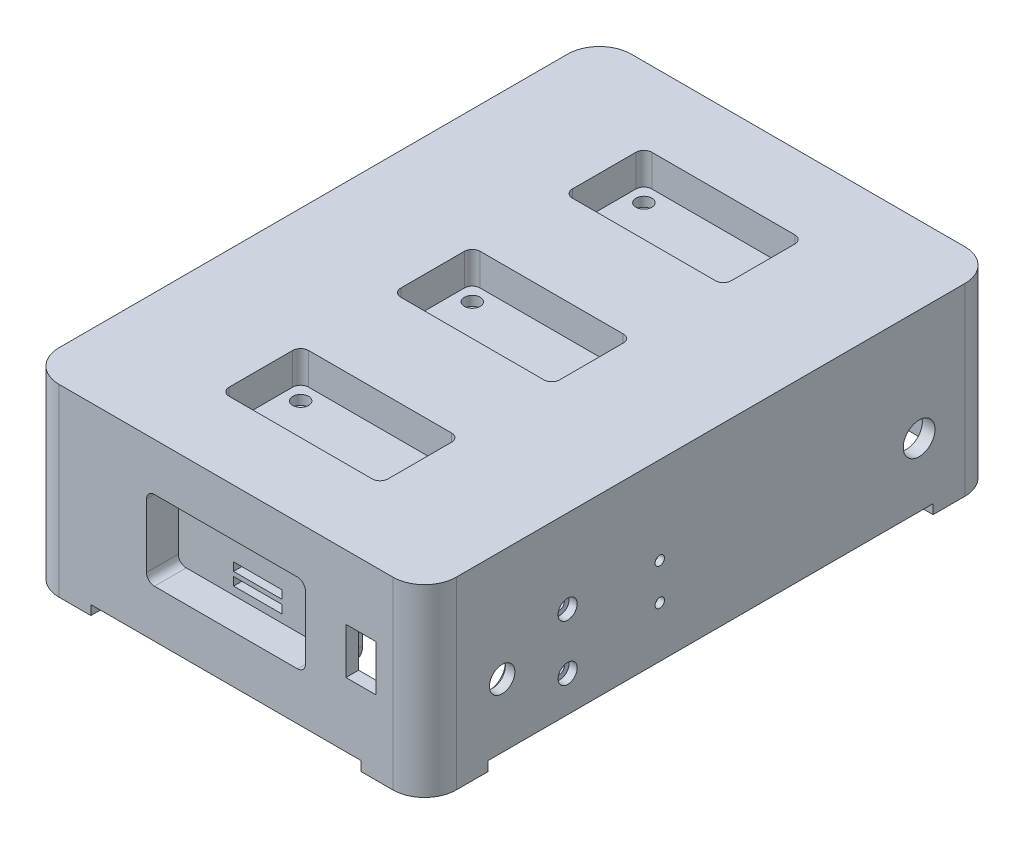
from build123d import *

# Parameters (mm, degrees)
SKETCH_1_W                = 125
SKETCH_1_H                = 180
EXTRUDE_1_DEPTH           = 55
CUT_EXTRUDE_1_DEPTH       = 10
CUT_EXTRUDE_2_DEPTH       = 10
SHELL_1_T                 = -4
SKETCH_5_R                = 1.45
SKETCH_5_R_2              = 4
SKETCH_5_R_3              = 5
CUT_EXTRUDE_3_DEPTH       = 15
SKETCH_6_R                = 3
CUT_EXTRUDE_4_DEPTH       = 2.5
SKETCH_11_R               = 5
CUT_EXTRUDE_16_DEPTH      = 1
SKETCH_12_R               = 1.45
CUT_EXTRUDE_17_DEPTH      = 14
SKETCH_15_R               = 2.5
SKETCH_15_W               = 15.2
SKETCH_15_H               = 2.6
CUT_EXTRUDE_20_DEPTH      = 3
SKETCH_16_W               = 14
SKETCH_16_H               = 1.8
CUT_EXTRUDE_21_DEPTH      = 3
SKETCH_17_R               = 2.5
SKETCH_17_W               = 15.2
SKETCH_17_H               = 2.6
CUT_EXTRUDE_22_DEPTH      = 3
SKETCH_18_W               = 14
SKETCH_18_H               = 1.8
CUT_EXTRUDE_23_DEPTH      = 3
SKETCH_19_R               = 2.5
SKETCH_19_W               = 15.2
SKETCH_19_H               = 2.6
CUT_EXTRUDE_24_DEPTH      = 3
SKETCH_20_W               = 14
SKETCH_20_H               = 1.8
CUT_EXTRUDE_25_DEPTH      = 5
SKETCH_21_W               = 9.5
SKETCH_21_H               = 14.5
CUT_EXTRUDE_26_DEPTH      = 4
SKETCH_22_R               = 1.425
CUT_EXTRUDE_27_DEPTH      = 9
SKETCH_24_R               = 1.475
CUT_EXTRUDE_28_DEPTH      = 164.554272338
FILLET_1_R                = 10
CUT_EXTRUDE_29_DEPTH      = 119
CUT_EXTRUDE_29_DEPTH_BACK = 2
FILLET_2_R                = 3
EXTRUDE_2_DEPTH           = 3
CUT_EXTRUDE_30_DEPTH      = 2.5


with BuildPart() as part:
    # Эскиз1 → Бобышка-Вытянуть1 (new body)
    with BuildSketch(Plane(origin=(0, 0, 0), x_dir=(1, 0, 0), z_dir=(0, 1, 0))):
        Rectangle(SKETCH_1_W, SKETCH_1_H)
    extrude(amount=EXTRUDE_1_DEPTH)

    # Эскиз2 → Вырез-Вытянуть1 (cut)
    with BuildSketch(Plane.XY.offset(90)):
        with BuildLine():
            Line((-22.5, 15), (22.5, 15))
            ThreePointArc((22.5, 15), (24.267766953, 15.732233047), (25, 17.5))
            Line((25, 17.5), (25, 37.5))
            ThreePointArc((25, 37.5), (24.267766953, 39.267766953), (22.5, 40))
            Line((22.5, 40), (-22.5, 40))
            ThreePointArc((-22.5, 40), (-24.267766953, 39.267766953), (-25, 37.5))
            Line((-25, 37.5), (-25, 17.5))
            ThreePointArc((-25, 17.5), (-24.267766953, 15.732233047), (-22.5, 15))
        make_face()
    cut_extrude_1 = extrude(amount=-CUT_EXTRUDE_1_DEPTH, mode=Mode.SUBTRACT)

    # Эскиз4 → Вырез-Вытянуть2 (cut)
    with BuildSketch(Plane(origin=(0, 55, 0), x_dir=(1, 0, 0), z_dir=(0, 1, 0))):
        with BuildLine():
            Line((-22.5, 41.5), (22.5, 41.5))
            ThreePointArc((22.5, 41.5), (24.267766953, 42.232233047), (25, 44))
            Line((25, 44), (25, 64))
            ThreePointArc((25, 64), (24.267766953, 65.767766953), (22.5, 66.5))
            Line((22.5, 66.5), (-22.5, 66.5))
            ThreePointArc((-22.5, 66.5), (-24.267766953, 65.767766953), (-25, 64))
            Line((-25, 64), (-25, 44))
            ThreePointArc((-25, 44), (-24.267766953, 42.232233047), (-22.5, 41.5))
        make_face()
        with BuildLine():
            Line((-22.5, -12.5), (22.5, -12.5))
            ThreePointArc((22.5, -12.5), (24.267766953, -11.767766953), (25, -10))
            Line((25, -10), (25, 10))
            ThreePointArc((25, 10), (24.267766953, 11.767766953), (22.5, 12.5))
            Line((22.5, 12.5), (-22.5, 12.5))
            ThreePointArc((-22.5, 12.5), (-24.267766953, 11.767766953), (-25, 10))
            Line((-25, 10), (-25, -10))
            ThreePointArc((-25, -10), (-24.267766953, -11.767766953), (-22.5, -12.5))
        make_face()
        with BuildLine():
            Line((-22.5, -66.5), (22.5, -66.5))
            ThreePointArc((22.5, -66.5), (24.267766953, -65.767766953), (25, -64))
            Line((25, -64), (25, -44))
            ThreePointArc((25, -44), (24.267766953, -42.232233047), (22.5, -41.5))
            Line((22.5, -41.5), (-22.5, -41.5))
            ThreePointArc((-22.5, -41.5), (-24.267766953, -42.232233047), (-25, -44))
            Line((-25, -44), (-25, -64))
            ThreePointArc((-25, -64), (-24.267766953, -65.767766953), (-22.5, -66.5))
        make_face()
    extrude(amount=-CUT_EXTRUDE_2_DEPTH, mode=Mode.SUBTRACT)

    # Зеркальное отражение1: Вырез-Вытянуть1 across plane
    add(cut_extrude_1.mirror(Plane.XY), mode=Mode.SUBTRACT)

    # Оболочка1
    shell_1_openings = [part.faces().sort_by_distance(p)[0] for p in [
        (0, 0, 0),
    ]]
    offset(amount=SHELL_1_T, openings=shell_1_openings, kind=Kind.INTERSECTION)

    # Эскиз5 → Вырез-Вытянуть3 (cut)
    with BuildSketch(Plane.ZY.offset(62.5)):
        with Locations((45, 28.75)):
            Circle(SKETCH_5_R)
        with Locations((45, 11.25)):
            Circle(SKETCH_5_R)
        with Locations((65.6, 20)):
            Circle(SKETCH_5_R_2)
        with Locations((-65.6, 20)):
            Circle(SKETCH_5_R_3)
    cut_extrude_3 = extrude(amount=-CUT_EXTRUDE_3_DEPTH, mode=Mode.SUBTRACT)

    # Эскиз6 → Вырез-Вытянуть4 (cut)
    with BuildSketch(Plane.ZY.offset(62.5)):
        with Locations((45, 28.75)):
            Circle(SKETCH_6_R)
        with Locations((45, 11.25)):
            Circle(SKETCH_6_R)
    cut_extrude_4 = extrude(amount=-CUT_EXTRUDE_4_DEPTH, mode=Mode.SUBTRACT)

    # Эскиз11 → Вырез-Вытянуть16 (cut)
    with BuildSketch(Plane(origin=(-58.5, 0, 0), x_dir=(0, 0, -1), z_dir=(1, 0, 0))):
        with Locations((-65.6, 20)):
            Circle(SKETCH_11_R)
    cut_extrude_16 = extrude(amount=-CUT_EXTRUDE_16_DEPTH, mode=Mode.SUBTRACT)

    # Зеркальное отражение2: Вырез-Вытянуть3, Вырез-Вытянуть4, Вырез-Вытянуть16 across plane
    add(cut_extrude_3.mirror(Plane(origin=(0, 0, 0), x_dir=(0, 0, 1), z_dir=(1, 0, 0))), mode=Mode.SUBTRACT)
    add(cut_extrude_4.mirror(Plane(origin=(0, 0, 0), x_dir=(0, 0, 1), z_dir=(1, 0, 0))), mode=Mode.SUBTRACT)
    add(cut_extrude_16.mirror(Plane(origin=(0, 0, 0), x_dir=(0, 0, 1), z_dir=(1, 0, 0))), mode=Mode.SUBTRACT)

    # Эскиз12 → Вырез-Вытянуть17 (cut)
    with BuildSketch(Plane(origin=(0, 11, 0), x_dir=(-1, 0, 0), z_dir=(0, -1, 0))):
        with Locations(Location((-10, -78, 0), (0, 0, 90))):
            Circle(SKETCH_12_R)
        with Locations(Location((10, -78, 0), (0, 0, 90))):
            Circle(SKETCH_12_R)
    extrude(amount=-CUT_EXTRUDE_17_DEPTH, mode=Mode.SUBTRACT)

    # Эскиз15 → Вырез-Вытянуть20 (cut)
    with BuildSketch(Plane(origin=(0, 45, 0), x_dir=(1, 0, 0), z_dir=(0, 1, 0))):
        with Locations(Location((-20, -46.5, 0), (0, 0, 270))):
            Circle(SKETCH_15_R)
        with Locations(Location((20, -46.5, 0), (0, 0, 270))):
            Circle(SKETCH_15_R)
        with Locations(Location((-20, 7.5, 0), (0, 0, 270))):
            Circle(SKETCH_15_R)
        with Locations(Location((20, 7.5, 0), (0, 0, 270))):
            Circle(SKETCH_15_R)
        with Locations(Location((-20, 61.5, 0), (0, 0, 270))):
            Circle(SKETCH_15_R)
        with Locations(Location((20, 61.5, 0), (0, 0, 270))):
            Circle(SKETCH_15_R)
        with Locations((0, -62.5)):
            Rectangle(SKETCH_15_W, SKETCH_15_H)
        with Locations((0, -8.5)):
            Rectangle(SKETCH_15_W, SKETCH_15_H)
        with Locations((0, 45.5)):
            Rectangle(SKETCH_15_W, SKETCH_15_H)
        with Locations((0, -58.5)):
            Rectangle(SKETCH_15_W, SKETCH_15_H)
        with Locations((0, -4.5)):
            Rectangle(SKETCH_15_W, SKETCH_15_H)
        with Locations((0, 49.5)):
            Rectangle(SKETCH_15_W, SKETCH_15_H)
    extrude(amount=-CUT_EXTRUDE_20_DEPTH, mode=Mode.SUBTRACT)

    # Эскиз16 → Вырез-Вытянуть21 (cut)
    with BuildSketch(Plane(origin=(0, 42, 0), x_dir=(1, 0, 0), z_dir=(0, 1, 0))):
        with Locations((0, -62.5)):
            Rectangle(SKETCH_16_W, SKETCH_16_H)
        with Locations((0, -8.5)):
            Rectangle(SKETCH_16_W, SKETCH_16_H)
        with Locations((0, 45.5)):
            Rectangle(SKETCH_16_W, SKETCH_16_H)
        with Locations((0, -58.5)):
            Rectangle(SKETCH_16_W, SKETCH_16_H)
        with Locations((0, -4.5)):
            Rectangle(SKETCH_16_W, SKETCH_16_H)
        with Locations((0, 49.5)):
            Rectangle(SKETCH_16_W, SKETCH_16_H)
    extrude(amount=-CUT_EXTRUDE_21_DEPTH, mode=Mode.SUBTRACT)

    # Эскиз17 → Вырез-Вытянуть22 (cut)
    with BuildSketch(Plane.XY.offset(80)):
        with Locations((-20, 35)):
            Circle(SKETCH_17_R)
        with Locations((20, 35)):
            Circle(SKETCH_17_R)
        with Locations((0, 18.8)):
            Rectangle(SKETCH_17_W, SKETCH_17_H)
        with Locations((0, 22.8)):
            Rectangle(SKETCH_17_W, SKETCH_17_H)
    extrude(amount=-CUT_EXTRUDE_22_DEPTH, mode=Mode.SUBTRACT)

    # Эскиз18 → Вырез-Вытянуть23 (cut)
    with BuildSketch(Plane.XY.offset(77)):
        with Locations((0, 18.8)):
            Rectangle(SKETCH_18_W, SKETCH_18_H)
        with Locations((0, 22.8)):
            Rectangle(SKETCH_18_W, SKETCH_18_H)
    extrude(amount=-CUT_EXTRUDE_23_DEPTH, mode=Mode.SUBTRACT)

    # Эскиз19 → Вырез-Вытянуть24 (cut)
    with BuildSketch(Plane(origin=(0, 0, -80), x_dir=(1, 0, 0), z_dir=(0, 0, -1))):
        with Locations(Location((-20, -20, 0), (0, 0, 270))):
            Circle(SKETCH_19_R)
        with Locations(Location((20, -20, 0), (0, 0, 270))):
            Circle(SKETCH_19_R)
        with Locations((0, -36.2)):
            Rectangle(SKETCH_19_W, SKETCH_19_H)
        with Locations((0, -32.2)):
            Rectangle(SKETCH_19_W, SKETCH_19_H)
    extrude(amount=-CUT_EXTRUDE_24_DEPTH, mode=Mode.SUBTRACT)

    # Эскиз20 → Вырез-Вытянуть25 (cut)
    with BuildSketch(Plane(origin=(0, 0, -77), x_dir=(1, 0, 0), z_dir=(0, 0, -1))):
        with Locations((0, -36.2)):
            Rectangle(SKETCH_20_W, SKETCH_20_H)
        with Locations((0, -32.2)):
            Rectangle(SKETCH_20_W, SKETCH_20_H)
    extrude(amount=-CUT_EXTRUDE_25_DEPTH, mode=Mode.SUBTRACT)

    # Эскиз21 → Вырез-Вытянуть26 (cut)
    with BuildSketch(Plane(origin=(0, 0, 90), x_dir=(1, 0, 0), z_dir=(0, 0, -1))):
        with Locations((42.5, -27.5)):
            Rectangle(SKETCH_21_W, SKETCH_21_H)
    extrude(amount=CUT_EXTRUDE_26_DEPTH, mode=Mode.SUBTRACT)

    # Эскиз22 → Вырез-Вытянуть27 (cut)
    with BuildSketch(Plane(origin=(0, 0, 0), x_dir=(-1, 0, 0), z_dir=(0, -1, 0))):
        with Locations(Location((0, 88, 0), (0, 0, 90))):
            Circle(SKETCH_22_R)
        with Locations(Location((0, -88, 0), (0, 0, 90))):
            Circle(SKETCH_22_R)
        with Locations(Location((-60.5, 0, 0), (0, 0, 90))):
            Circle(SKETCH_22_R)
        with Locations(Location((60.5, 0, 0), (0, 0, 90))):
            Circle(SKETCH_22_R)
    extrude(amount=-CUT_EXTRUDE_27_DEPTH, mode=Mode.SUBTRACT)

    # Эскиз24 → Вырез-Вытянуть28 (cut, through all)
    with BuildSketch(Plane.ZY.offset(62.5)):
        with Locations((16, 16)):
            Circle(SKETCH_24_R)
        with Locations((16, 27.5)):
            Circle(SKETCH_24_R)
    extrude(amount=-CUT_EXTRUDE_28_DEPTH, mode=Mode.SUBTRACT)

    # Скругление1
    fillet_1_edges = [part.edges().sort_by_distance(p)[0] for p in [
        (62.5, 27.5, 90),
        (-62.5, 27.5, 90),
        (-62.5, 27.5, -90),
        (62.5, 27.5, -90),
    ]]
    fillet(fillet_1_edges, radius=FILLET_1_R)

    # Эскиз26 → Вырез-Вытянуть29 (cut, two sides: drawn at the far end of the back side and taken through both)
    with BuildSketch(Plane.ZY.offset(-58.5).offset(-CUT_EXTRUDE_29_DEPTH_BACK)):
        Polygon((17.645448267, 18.85), (14.354551733, 18.85), (12.709103466, 16), (14.354551733, 13.15), (17.645448267, 13.15), (19.290896534, 16), align=None)
        Polygon((17.645448267, 30.35), (14.354551733, 30.35), (12.709103466, 27.5), (14.354551733, 24.65), (17.645448267, 24.65), (19.290896534, 27.5), align=None)
    extrude(amount=CUT_EXTRUDE_29_DEPTH + CUT_EXTRUDE_29_DEPTH_BACK, mode=Mode.SUBTRACT)

    # Скругление2
    fillet_2_edges = [part.edges().sort_by_distance(p)[0] for p in [
        (58.5, 25.5, -86),
        (58.5, 25.5, 86),
        (-58.5, 25.5, -86),
        (-58.5, 25.5, 86),
    ]]
    fillet(fillet_2_edges, radius=FILLET_2_R)

    # Эскиз27 → Бобышка-Вытянуть2 (add)
    with BuildSketch(Plane.XZ):
        with BuildLine():
            Line((-52.5, -90), (-42.5, -90))
            Line((-42.5, -90), (-42.5, -86))
            Line((-42.5, -86), (-55.5, -86))
            ThreePointArc((-55.5, -86), (-57.621320344, -85.121320344), (-58.5, -83))
            Line((-58.5, -83), (-58.5, -70))
            Line((-58.5, -70), (-62.5, -70))
            Line((-62.5, -70), (-62.5, -80))
            ThreePointArc((-62.5, -80), (-59.571067812, -87.071067812), (-52.5, -90))
        make_face()
        with BuildLine():
            Line((62.5, -70), (62.5, -80))
            ThreePointArc((62.5, -80), (59.571067812, -87.071067812), (52.5, -90))
            Line((52.5, -90), (42.5, -90))
            Line((42.5, -90), (42.5, -86))
            Line((42.5, -86), (55.5, -86))
            ThreePointArc((55.5, -86), (57.621320344, -85.121320344), (58.5, -83))
            Line((58.5, -83), (58.5, -70))
            Line((58.5, -70), (62.5, -70))
        make_face()
        with BuildLine():
            Line((52.5, 90), (42.5, 90))
            Line((42.5, 90), (42.5, 86))
            Line((42.5, 86), (55.5, 86))
            ThreePointArc((55.5, 86), (57.621320344, 85.121320344), (58.5, 83))
            Line((58.5, 83), (58.5, 70))
            Line((58.5, 70), (62.5, 70))
            Line((62.5, 70), (62.5, 80))
            ThreePointArc((62.5, 80), (59.571067812, 87.071067812), (52.5, 90))
        make_face()
        with BuildLine():
            Line((-62.5, 70), (-62.5, 80))
            ThreePointArc((-62.5, 80), (-59.571067812, 87.071067812), (-52.5, 90))
            Line((-52.5, 90), (-42.5, 90))
            Line((-42.5, 90), (-42.5, 86))
            Line((-42.5, 86), (-55.5, 86))
            ThreePointArc((-55.5, 86), (-57.621320344, 85.121320344), (-58.5, 83))
            Line((-58.5, 83), (-58.5, 70))
            Line((-58.5, 70), (-62.5, 70))
        make_face()
    extrude(amount=EXTRUDE_2_DEPTH)

    # Эскиз28 → Вырез-Вытянуть30 (cut)
    with BuildSketch(Plane.XZ):
        with BuildLine():
            Line((-58.5, 70), (-58.5, 83))
            ThreePointArc((-58.5, 83), (-57.621320344, 85.121320344), (-55.5, 86))
            Line((-55.5, 86), (-42.5, 86))
            Line((-42.5, 86), (-42.5, 86.5))
            Line((-42.5, 86.5), (-55.5, 86.5))
            ThreePointArc((-55.5, 86.5), (-57.974873734, 85.474873734), (-59, 83))
            Line((-59, 83), (-59, 70))
            Line((-59, 70), (-58.5, 70))
        make_face()
        with BuildLine():
            Line((59, 70), (58.5, 70))
            Line((58.5, 70), (58.5, 83))
            ThreePointArc((58.5, 83), (57.621320344, 85.121320344), (55.5, 86))
            Line((55.5, 86), (42.5, 86))
            Line((42.5, 86), (42.5, 86.5))
            Line((42.5, 86.5), (55.5, 86.5))
            ThreePointArc((55.5, 86.5), (57.974873734, 85.474873734), (59, 83))
            Line((59, 83), (59, 70))
        make_face()
        with BuildLine():
            Line((58.5, -70), (58.5, -83))
            ThreePointArc((58.5, -83), (57.621320344, -85.121320344), (55.5, -86))
            Line((55.5, -86), (42.5, -86))
            Line((42.5, -86), (42.5, -86.5))
            Line((42.5, -86.5), (55.5, -86.5))
            ThreePointArc((55.5, -86.5), (57.974873734, -85.474873734), (59, -83))
            Line((59, -83), (59, -70))
            Line((59, -70), (58.5, -70))
        make_face()
        with BuildLine():
            Line((-59, -70), (-58.5, -70))
            Line((-58.5, -70), (-58.5, -83))
            ThreePointArc((-58.5, -83), (-57.621320344, -85.121320344), (-55.5, -86))
            Line((-55.5, -86), (-42.5, -86))
            Line((-42.5, -86), (-42.5, -86.5))
            Line((-42.5, -86.5), (-55.5, -86.5))
            ThreePointArc((-55.5, -86.5), (-57.974873734, -85.474873734), (-59, -83))
            Line((-59, -83), (-59, -70))
        make_face()
    extrude(amount=CUT_EXTRUDE_30_DEPTH, mode=Mode.SUBTRACT)


solid = part.part
